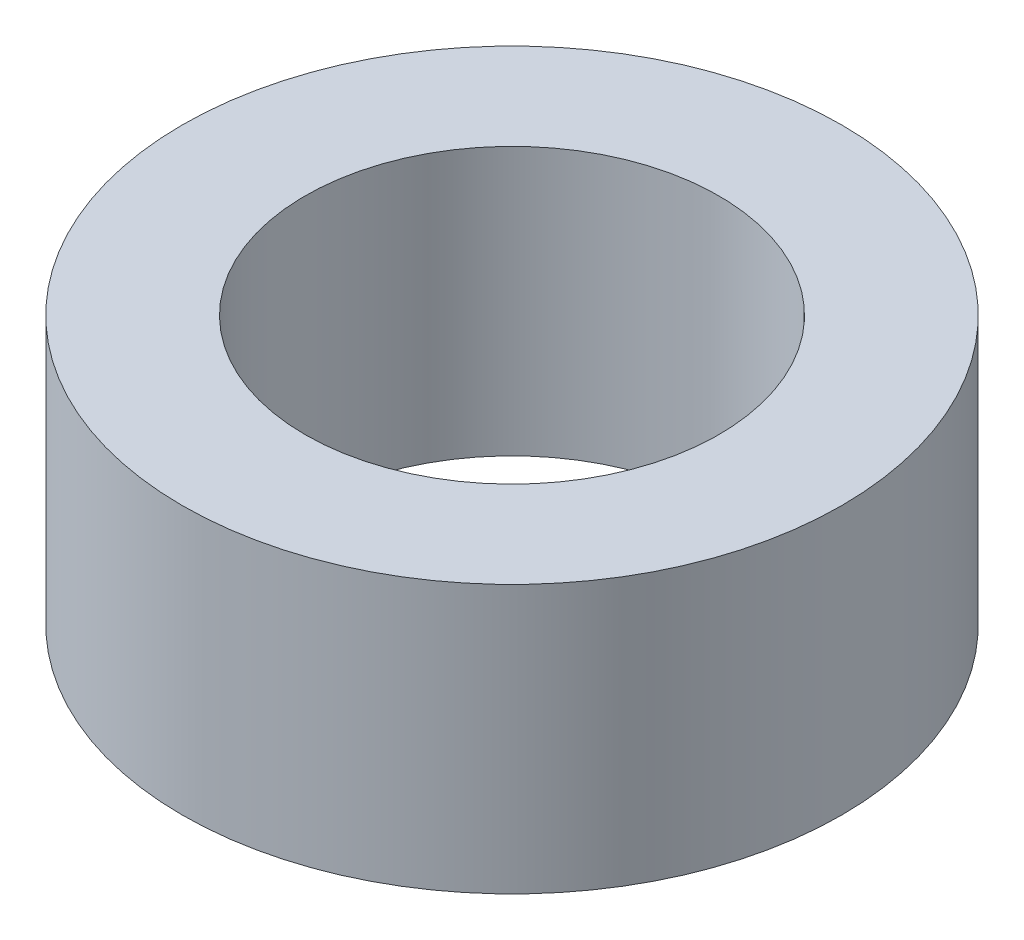
from build123d import *

# Parameters (mm, degrees)
SKETCH1_R           = 3.69
BOSS_EXTRUDE3_DEPTH = 3
SKETCH3_R           = 2.006520574
CUT_EXTRUDE2_DEPTH  = 3
SKETCH4_R           = 2.315250801
CUT_EXTRUDE3_DEPTH  = 3


with BuildPart() as part:
    # Sketch1 → Boss-Extrude3 (new body)
    with BuildSketch(Plane(origin=(0, 0, 0), x_dir=(1, 0, 0), z_dir=(0, 1, 0))):
        with Locations(Location((0, 0, 0), (0, 0, 270))):
            Circle(SKETCH1_R)
    extrude(amount=BOSS_EXTRUDE3_DEPTH)

    # Sketch3 → Cut-Extrude2 (cut)
    with BuildSketch(Plane(origin=(0, 3, 0), x_dir=(1, 0, 0), z_dir=(0, 1, 0))):
        with Locations(Location((0, 0, 0), (0, 0, 270))):
            Circle(SKETCH3_R)
    extrude(amount=-CUT_EXTRUDE2_DEPTH, mode=Mode.SUBTRACT)

    # Sketch4 → Cut-Extrude3 (cut)
    with BuildSketch(Plane(origin=(0, 3, 0), x_dir=(1, 0, 0), z_dir=(0, 1, 0))):
        with Locations(Location((0, 0, 0), (0, 0, 270))):
            Circle(SKETCH4_R)
    extrude(amount=-CUT_EXTRUDE3_DEPTH, mode=Mode.SUBTRACT)


solid = part.part
